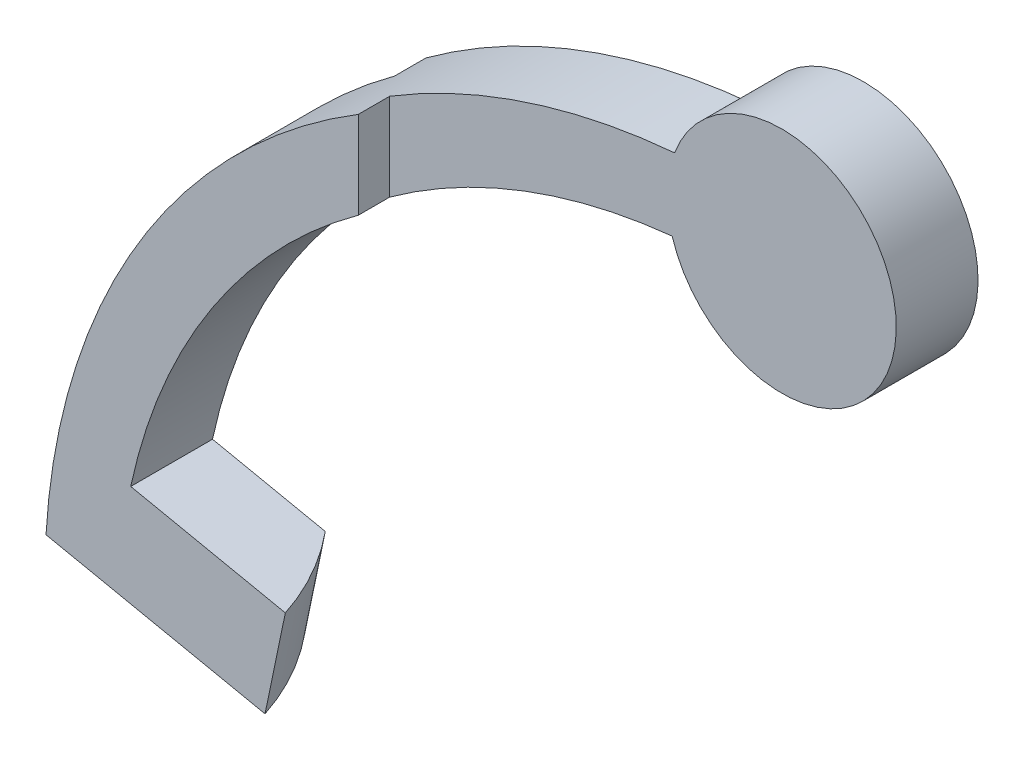
from build123d import *

# Parameters (mm, degrees)
BOSS_EXTRU_2_DEPTH           = 5
BOSS_EXTRU_3_DEPTH           = 45
ENL_V_MAT_EXTRU_3_DEPTH      = 5
ENL_V_MAT_EXTRU_3_DEPTH_BACK = 73.880031702
ESQUISSE4_4_W                = 16.307493561
ESQUISSE4_4_H                = 1.918484986
ENL_V_MAT_EXTRU_4_DEPTH      = 58.743956008
ENL_V_MAT_EXTRU_6_DEPTH      = 57.375584133


with BuildPart() as part:
    # Esquisse3 → Boss.-Extru.2 (new body)
    with BuildSketch(Plane.XY):
        with BuildLine():
            ThreePointArc((7, 0), (1.246257582, 6.888166813), (-6.556240583, 2.452694319))
            ThreePointArc((-6.556240583, 2.452694319), (-6.99644453, 0.22307834), (-6.699170831, -2.030051767))
            ThreePointArc((-6.699170831, -2.030051767), (1.026110175, -6.924384298), (7, 0))
        make_face()
    extrude(amount=BOSS_EXTRU_2_DEPTH)

    # Esquisse3<3> → Boss.-Extru.3 (add)
    with BuildSketch(Plane.XY):
        with BuildLine():
            ThreePointArc((-6.556240583, 2.452694319), (-31.795381091, -9.503990443), (-43.059714875, -35.059641647))
            Line((-43.059714875, -35.059641647), (-29.67043681, -37.846531887))
            Line((-29.67043681, -37.846531887), (-28.42882324, -31.881349224))
            Line((-28.42882324, -31.881349224), (-37.880972605, -29.913946449))
            ThreePointArc((-37.880972605, -29.913946449), (-26.825365644, -10.900303142), (-6.699170831, -2.030051767))
            ThreePointArc((-6.699170831, -2.030051767), (-6.99644453, 0.22307834), (-6.556240583, 2.452694319))
        make_face()
    extrude(amount=BOSS_EXTRU_3_DEPTH)

    # Esquisse4 → Enlèv. mat.-Extru.3 (cut, two sides: drawn at the far end of the back side and taken through both)
    with BuildSketch(Plane(origin=(0, 0, 0), x_dir=(1, 0, 0), z_dir=(0, 1, 0)).offset(-ENL_V_MAT_EXTRU_3_DEPTH_BACK)):
        Polygon((-6.556240583, -21.643777245), (-6.556240583, -5), (-23.967427217, -5), (-23.967427217, -6.918484986), (-43.059714875, -6.918484986), (-43.059714875, -11.918484986), (-43.059714875, -45), (-43.059714875, -53.527020644), (-6.425184121, -53.527020644), align=None)
    extrude(amount=ENL_V_MAT_EXTRU_3_DEPTH + ENL_V_MAT_EXTRU_3_DEPTH_BACK, mode=Mode.SUBTRACT)

    # Esquisse4<4> → Enlèv. mat.-Extru.4 (cut, through all)
    with BuildSketch(Plane(origin=(0, 0, 0), x_dir=(1, 0, 0), z_dir=(0, 1, 0))):
        with Locations((-34.905968095, -0.959242493)):
            Rectangle(ESQUISSE4_4_W, ESQUISSE4_4_H)
    extrude(amount=-ENL_V_MAT_EXTRU_4_DEPTH, mode=Mode.SUBTRACT)

    # Esquisse5 → Enlèv. mat.-Extru.6 (cut, through all)
    with BuildSketch(Plane(origin=(-7.540837864, -36.229046112, 0), x_dir=(0.9790175257089632, -0.2037760642340011, 0), z_dir=(0.2037760642340011, 0.9790175257089632, 0))):
        with BuildLine():
            Line((-23.948753957, -1.918484986), (-21.33566032, -1.918484986))
            Line((-21.33566032, -1.918484986), (-21.33566032, -6.918484986))
            ThreePointArc((-21.33566032, -6.918484986), (-22.389352617, -4.286338478), (-23.948753957, -1.918484986))
        make_face()
    extrude(amount=-ENL_V_MAT_EXTRU_6_DEPTH, mode=Mode.SUBTRACT)


solid = part.part
